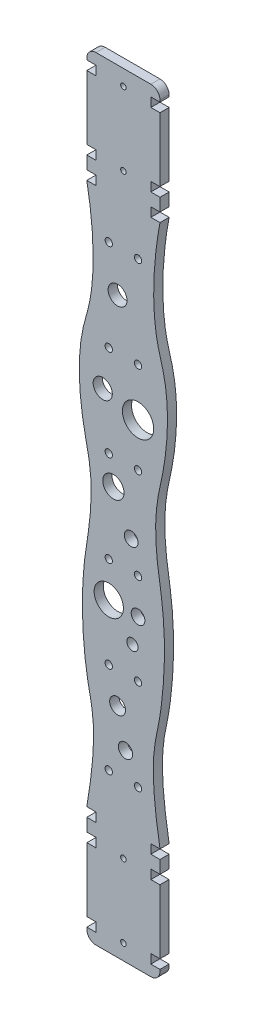
from build123d import *

# Parameters (mm, degrees)
ESQUISSE1_R        = 1.5
ESQUISSE1_R_2      = 2
ESQUISSE1_R_3      = 5.229109031
ESQUISSE1_R_4      = 8.551995964
ESQUISSE1_R_5      = 5.158177567
ESQUISSE1_R_6      = 8
ESQUISSE1_R_7      = 3.072157836
ESQUISSE1_R_8      = 3.743275554
ESQUISSE1_R_9      = 4.322126927
ESQUISSE1_R_10     = 3.914500571
ESQUISSE1_R_11     = 5.819859564
BOSS_EXTRU_1_DEPTH = 5
CONG_1_R           = 5


with BuildPart() as part:
    # Esquisse1 → Boss.-Extru.1 (new body)
    with BuildSketch(Plane.XY):
        with BuildLine():
            Line((-20, 0), (20, 0))
            Line((20, 0), (20, 6))
            Line((20, 6), (15, 6))
            Line((15, 6), (15, 11))
            Line((15, 11), (20, 11))
            Line((20, 11), (19.933455672, 46))
            Line((19.933455672, 46), (15, 46))
            Line((15, 46), (15, 51))
            Line((15, 51), (20, 51))
            Line((20, 51), (20, 58))
            Line((20, 58), (15, 58))
            Line((15, 58), (15, 63))
            Line((15, 63), (20, 63))
            add(Edge.make_bspline(
                [(20, 359.45), (16.079082377, 338.994180612), (15.061734436, 311.052574653), (26.220981942, 277.41099536), (23.571616688, 249.286480825), (16.894695055, 221.643219809), (17.320311392, 203.573817226), (23.179497877, 169.525790044), (22.715740478, 143.838000901), (18.09702301, 113.34806448), (13.512866268, 101.05247313), (20, 63)],
                knots=[0, 0, 0, 0, 0.154869589, 0.19499378, 0.378325457, 0.421485467, 0.583433866, 0.627024504, 0.813801208, 0.853433467, 1, 1, 1, 1], degree=3))
            Line((20, 359.45), (15, 359.45))
            Line((15, 359.45), (15, 364.45))
            Line((15, 364.45), (20, 364.45))
            Line((20, 364.45), (20, 371.45))
            Line((20, 371.45), (15, 371.45))
            Line((15, 371.45), (15, 376.45))
            Line((15, 376.45), (19.933455672, 376.45))
            Line((19.933455672, 376.45), (20, 411.45))
            Line((20, 411.45), (15, 411.45))
            Line((15, 411.45), (15, 416.45))
            Line((15, 416.45), (20, 416.45))
            Line((20, 416.45), (20, 422.45))
            Line((20, 422.45), (-20, 422.45))
            Line((-20, 422.45), (-20, 416.45))
            Line((-20, 416.45), (-15, 416.45))
            Line((-15, 416.45), (-15, 411.45))
            Line((-15, 411.45), (-20, 411.45))
            Line((-20, 411.45), (-19.933455672, 376.45))
            Line((-19.933455672, 376.45), (-15, 376.45))
            Line((-15, 376.45), (-15, 371.45))
            Line((-15, 371.45), (-20, 371.45))
            Line((-20, 371.45), (-20, 364.45))
            Line((-20, 364.45), (-15, 364.45))
            Line((-15, 364.45), (-15, 359.45))
            Line((-15, 359.45), (-20, 359.45))
            add(Edge.make_bspline(
                [(-20, 359.45), (-16.079082377, 338.994180612), (-15.061734436, 311.052574653), (-26.220981942, 277.41099536), (-23.571616688, 249.286480825), (-16.894695055, 221.643219809), (-17.320311392, 203.573817226), (-23.179497877, 169.525790044), (-22.715740478, 143.838000901), (-18.09702301, 113.34806448), (-13.512866268, 101.05247313), (-20, 63)],
                knots=[0, 0, 0, 0, 0.154869589, 0.19499378, 0.378325457, 0.421485467, 0.583433866, 0.627024504, 0.813801208, 0.853433467, 1, 1, 1, 1], degree=3))
            Line((-20, 63), (-15, 63))
            Line((-15, 63), (-15, 58))
            Line((-15, 58), (-20, 58))
            Line((-20, 58), (-20, 51))
            Line((-20, 51), (-15, 51))
            Line((-15, 51), (-15, 46))
            Line((-15, 46), (-19.933455672, 46))
            Line((-19.933455672, 46), (-20, 11))
            Line((-20, 11), (-15, 11))
            Line((-15, 11), (-15, 6))
            Line((-15, 6), (-20, 6))
            Line((-20, 6), (-20, 0))
        make_face()
        with Locations((0, 48.5)):
            Circle(ESQUISSE1_R, mode=Mode.SUBTRACT)
        with Locations((0, 8.5)):
            Circle(ESQUISSE1_R, mode=Mode.SUBTRACT)
        with Locations(Location((0, 413.95, 0), (0, 0, 180))):
            Circle(ESQUISSE1_R, mode=Mode.SUBTRACT)
        with Locations(Location((0, 373.95, 0), (0, 0, 180))):
            Circle(ESQUISSE1_R, mode=Mode.SUBTRACT)
        with Locations((-8, 336.225)):
            Circle(ESQUISSE1_R_2, mode=Mode.SUBTRACT)
        with Locations(Location((8, 336.225, 0), (0, 0, 180))):
            Circle(ESQUISSE1_R_2, mode=Mode.SUBTRACT)
        with Locations(Location((8, 286.225, 0), (0, 0, 180))):
            Circle(ESQUISSE1_R_2, mode=Mode.SUBTRACT)
        with Locations((-8, 286.225)):
            Circle(ESQUISSE1_R_2, mode=Mode.SUBTRACT)
        with Locations(Location((8, 236.225, 0), (0, 0, 180))):
            Circle(ESQUISSE1_R_2, mode=Mode.SUBTRACT)
        with Locations((-8, 236.225)):
            Circle(ESQUISSE1_R_2, mode=Mode.SUBTRACT)
        with Locations(Location((8, 186.225, 0), (0, 0, 180))):
            Circle(ESQUISSE1_R_2, mode=Mode.SUBTRACT)
        with Locations((-8, 186.225)):
            Circle(ESQUISSE1_R_2, mode=Mode.SUBTRACT)
        with Locations(Location((8, 136.225, 0), (0, 0, 180))):
            Circle(ESQUISSE1_R_2, mode=Mode.SUBTRACT)
        with Locations((-8, 136.225)):
            Circle(ESQUISSE1_R_2, mode=Mode.SUBTRACT)
        with Locations(Location((8, 86.225, 0), (0, 0, 180))):
            Circle(ESQUISSE1_R_2, mode=Mode.SUBTRACT)
        with Locations((-8, 86.225)):
            Circle(ESQUISSE1_R_2, mode=Mode.SUBTRACT)
        with Locations((-11.299380195, 265.282644745)):
            Circle(ESQUISSE1_R_3, mode=Mode.SUBTRACT)
        with Locations((8, 260.053535714)):
            Circle(ESQUISSE1_R_4, mode=Mode.SUBTRACT)
        with Locations((-3.185769016, 313.558631262)):
            Circle(ESQUISSE1_R_5, mode=Mode.SUBTRACT)
        with Locations((-8, 166.864541141)):
            Circle(ESQUISSE1_R_6, mode=Mode.SUBTRACT)
        with Locations((4.927842164, 152.260041018)):
            Circle(ESQUISSE1_R_7, mode=Mode.SUBTRACT)
        with Locations((8, 166.864541141)):
            Circle(ESQUISSE1_R_8, mode=Mode.SUBTRACT)
        with Locations((-3.185769016, 119.156507407)):
            Circle(ESQUISSE1_R_9, mode=Mode.SUBTRACT)
        with Locations((1.136357912, 100.170657248)):
            Circle(ESQUISSE1_R_10, mode=Mode.SUBTRACT)
        with Locations((4.256724446, 201.915341435)):
            Circle(ESQUISSE1_R_8, mode=Mode.SUBTRACT)
        with Locations((-5.471114106, 221.7141193)):
            Circle(ESQUISSE1_R_11, mode=Mode.SUBTRACT)
    extrude(amount=BOSS_EXTRU_1_DEPTH)

    # Congé1
    cong_1_edges = [part.edges().sort_by_distance(p)[0] for p in [
        (-20, 422.45, 2.5),
        (20, 422.45, 2.5),
        (20, 0, 2.5),
        (-20, 0, 2.5),
    ]]
    fillet(cong_1_edges, radius=CONG_1_R)


solid = part.part
